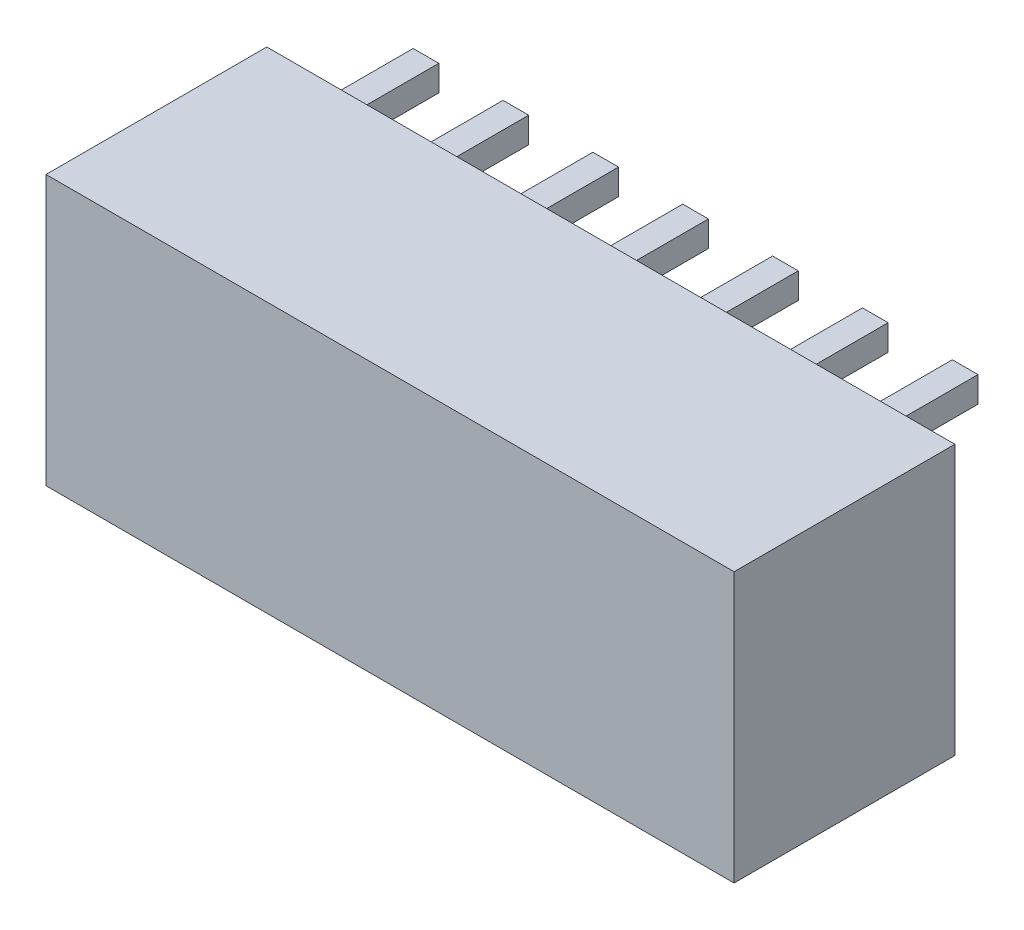
from build123d import *

# Parameters (mm, degrees)
SKETCH_1_W                         = 26.8
SKETCH_1_H                         = 10.5
EXTRUDE_1_DEPTH                    = 8.6
CUT_EXTRUDE_1_DEPTH                = 7
EXTRUDE_START                      = -5
SKETCH_3_W                         = 1
SKETCH_3_H                         = 1
EXTRUDE_2_DEPTH                    = 8.6
CHAMFER_1_SIZE                     = 0.3
PATTERN_LINEAR_1_COUNT             = 7
PATTERN_LINEAR_1_PITCH             = 3.5
CHAMFER_1_OF_PATTERN_LINEAR_1_SIZE = 0.3


with BuildPart() as part:
    # Эскиз1 → Бобышка-Вытянуть1 (new body)
    with BuildSketch(Plane.XY):
        Rectangle(SKETCH_1_W, SKETCH_1_H)
    extrude(amount=EXTRUDE_1_DEPTH)

    # Эскиз2 → Вырез-Вытянуть1 (cut)
    with BuildSketch(Plane.XZ.offset(5.25)):
        Polygon((-12.4, 6.6), (12.4, 6.6), (12.4, 0.2), (10.2, 0.2), (10.2, 1.8), (-8.6, 1.8), (-8.6, 0.2), (-10.8, 0.2), (-10.8, 1.8), (-12.4, 1.8), align=None)
    extrude(amount=-CUT_EXTRUDE_1_DEPTH, mode=Mode.SUBTRACT)

    # Эскиз3 → Бобышка-Вытянуть2 (add)
    with BuildSketch(Plane(origin=(0, 0, 0), x_dir=(-1, 0, 0), z_dir=(0, 0, -1)).offset(EXTRUDE_START)):
        with Locations((10.5, 4.25)):
            Rectangle(SKETCH_3_W, SKETCH_3_H)
    extrude_2 = extrude(amount=EXTRUDE_2_DEPTH)

    # Фаска1
    chamfer_1_edges = [part.edges().sort_by_distance(p)[0] for p in [
        (-10, 4.25, -3.6),
        (-10.5, 3.75, -3.6),
        (-11, 4.25, -3.6),
        (-10.5, 4.75, -3.6),
    ]]
    chamfer(chamfer_1_edges, length=CHAMFER_1_SIZE)

    # Линейный массив1: Бобышка-Вытянуть2 ×7
    with Locations(*[(i * PATTERN_LINEAR_1_PITCH, 0, 0) for i in range(1, PATTERN_LINEAR_1_COUNT)]):
        add(extrude_2)

    # Фаска1 of Линейный массив1
    chamfer_1_of_pattern_linear_1_edges = [part.edges().sort_by_distance(p)[0] for p in [
        (-6.5, 4.25, -3.6),
        (-7, 3.75, -3.6),
        (-7.5, 4.25, -3.6),
        (-7, 4.75, -3.6),
        (-3, 4.25, -3.6),
        (-3.5, 3.75, -3.6),
        (-4, 4.25, -3.6),
        (-3.5, 4.75, -3.6),
        (0.5, 4.25, -3.6),
        (0, 3.75, -3.6),
        (-0.5, 4.25, -3.6),
        (0, 4.75, -3.6),
        (4, 4.25, -3.6),
        (3.5, 3.75, -3.6),
        (3, 4.25, -3.6),
        (3.5, 4.75, -3.6),
        (7.5, 4.25, -3.6),
        (7, 3.75, -3.6),
        (6.5, 4.25, -3.6),
        (7, 4.75, -3.6),
        (11, 4.25, -3.6),
        (10.5, 3.75, -3.6),
        (10, 4.25, -3.6),
        (10.5, 4.75, -3.6),
    ]]
    chamfer(chamfer_1_of_pattern_linear_1_edges, length=CHAMFER_1_OF_PATTERN_LINEAR_1_SIZE)


solid = part.part
